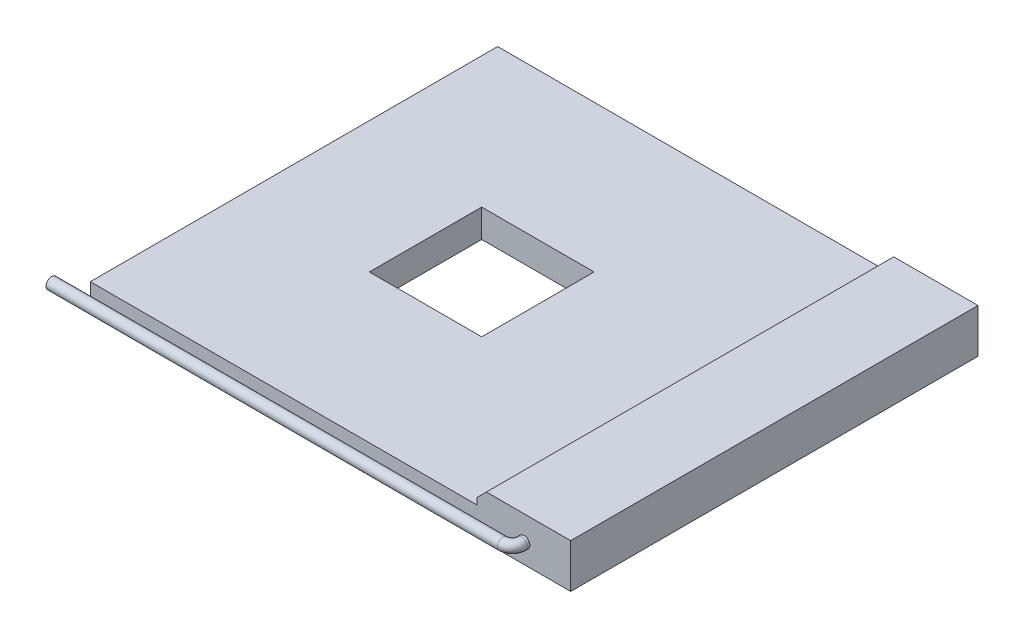
from build123d import *

# Parameters (mm, degrees)
SKETCH1_W           = 51.3
SKETCH1_H           = 43.5
BOSS_EXTRUDE1_DEPTH = 3
SKETCH2_W           = 12
SKETCH2_H           = 12
CUT_EXTRUDE1_DEPTH  = 3
SKETCH3_W           = 10
SKETCH3_H           = 43.5
BOSS_EXTRUDE2_DEPTH = 1.7
CHAMFER1_SIZE       = 1
SKETCH4_R           = 0.6


with BuildPart() as part:
    # Sketch1 → Boss-Extrude1 (new body)
    with BuildSketch(Plane(origin=(0, 0, 0), x_dir=(1, 0, 0), z_dir=(0, 1, 0))):
        Rectangle(SKETCH1_W, SKETCH1_H)
    extrude(amount=BOSS_EXTRUDE1_DEPTH)

    # Sketch2 → Cut-Extrude1 (cut)
    with BuildSketch(Plane(origin=(0, 3, 0), x_dir=(1, 0, 0), z_dir=(0, 1, 0))):
        with Locations((-5.65, 0.05)):
            Rectangle(SKETCH2_W, SKETCH2_H)
    extrude(amount=-CUT_EXTRUDE1_DEPTH, mode=Mode.SUBTRACT)

    # Sketch3 → Boss-Extrude2 (add)
    with BuildSketch(Plane(origin=(0, 3, 0), x_dir=(1, 0, 0), z_dir=(0, 1, 0))):
        with Locations((20.65, 0)):
            Rectangle(SKETCH3_W, SKETCH3_H)
    extrude(amount=BOSS_EXTRUDE2_DEPTH)

    # Chamfer1
    chamfer1_edges = [part.edges().sort_by_distance(p)[0] for p in [
        (15.65, 4.7, 0),
    ]]
    chamfer(chamfer1_edges, length=CHAMFER1_SIZE)

    # handle: sweep along a path in Sketch5
    with BuildLine(Plane(origin=(0, 3, 0), x_dir=(1, 0, 0), z_dir=(0, 1, 0))) as handle_path:
        Line((20.68654036, -21.75), (20.68654036, -22.031235757))
        ThreePointArc((20.68654036, -22.031235757), (20.393647141, -22.738342538), (19.68654036, -23.031235757))
        Line((19.68654036, -23.031235757), (-28.502744804, -23.031235757))
    # Sketch4 → handle (sweep)
    with BuildSketch(Plane.XY.offset(21.75)):
        with Locations((20.68654036, 2.094896924)):
            Circle(SKETCH4_R)
    sweep(path=handle_path.line)


solid = part.part
